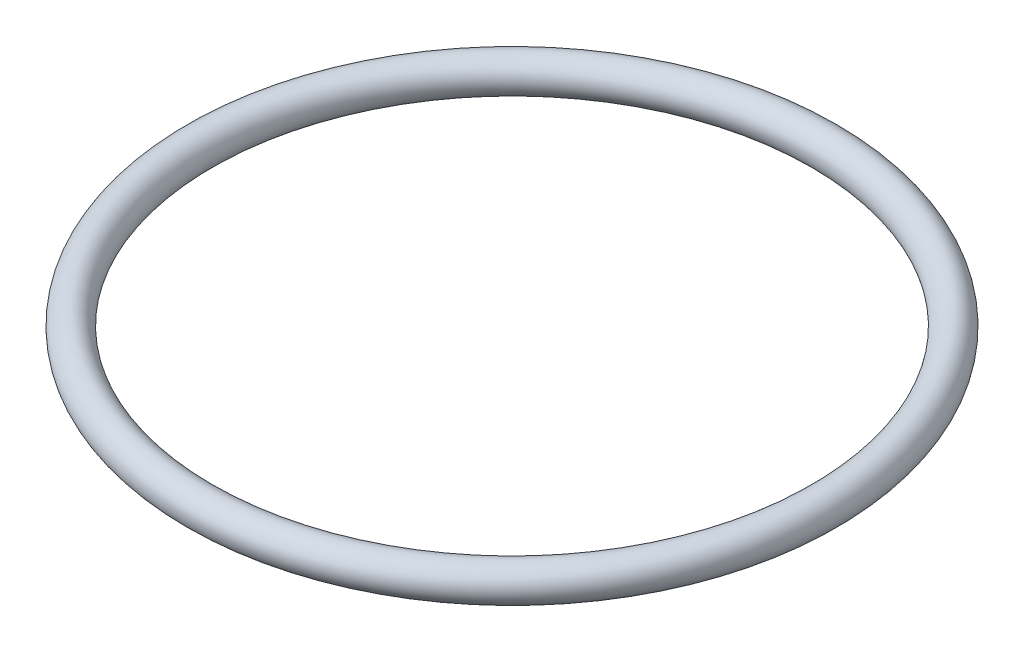
from build123d import *

# Parameters (mm, degrees)
ESQUISSE1_R = 1.25


with BuildPart() as part:
    # Esquisse1 → Révolution1 (revolve)
    with BuildSketch(Plane.XY, mode=Mode.PRIVATE) as r_volution1_sk:
        with Locations((-22.25, 0)):
            Circle(ESQUISSE1_R)
    revolve(r_volution1_sk.sketch.rotate(Axis((0, 0, 0), (0, 1, 0)), 270), axis=Axis((0, 0, 0), (0, 1, 0)))


solid = part.part
